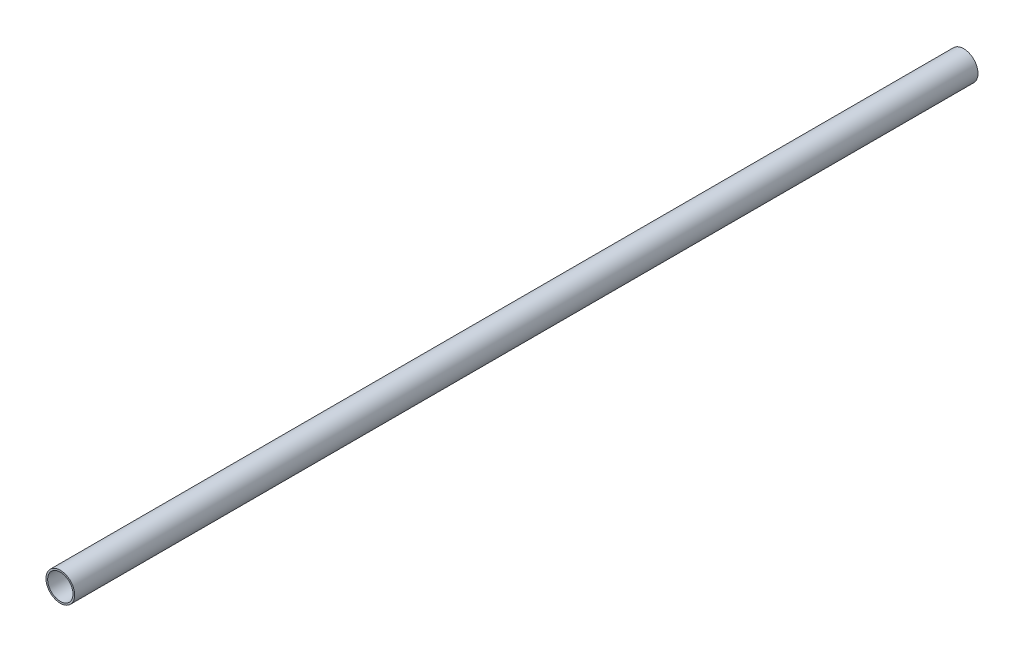
from build123d import *

# Parameters (mm, degrees)
SKETCH1_R           = 12.7
SKETCH1_R_2         = 11.227
BOSS_EXTRUDE1_DEPTH = 800


with BuildPart() as part:
    # Sketch1 → Boss-Extrude1 (new body)
    with BuildSketch(Plane.XY):
        Circle(SKETCH1_R)
        Circle(SKETCH1_R_2, mode=Mode.SUBTRACT)
    extrude(amount=BOSS_EXTRUDE1_DEPTH)


solid = part.part
